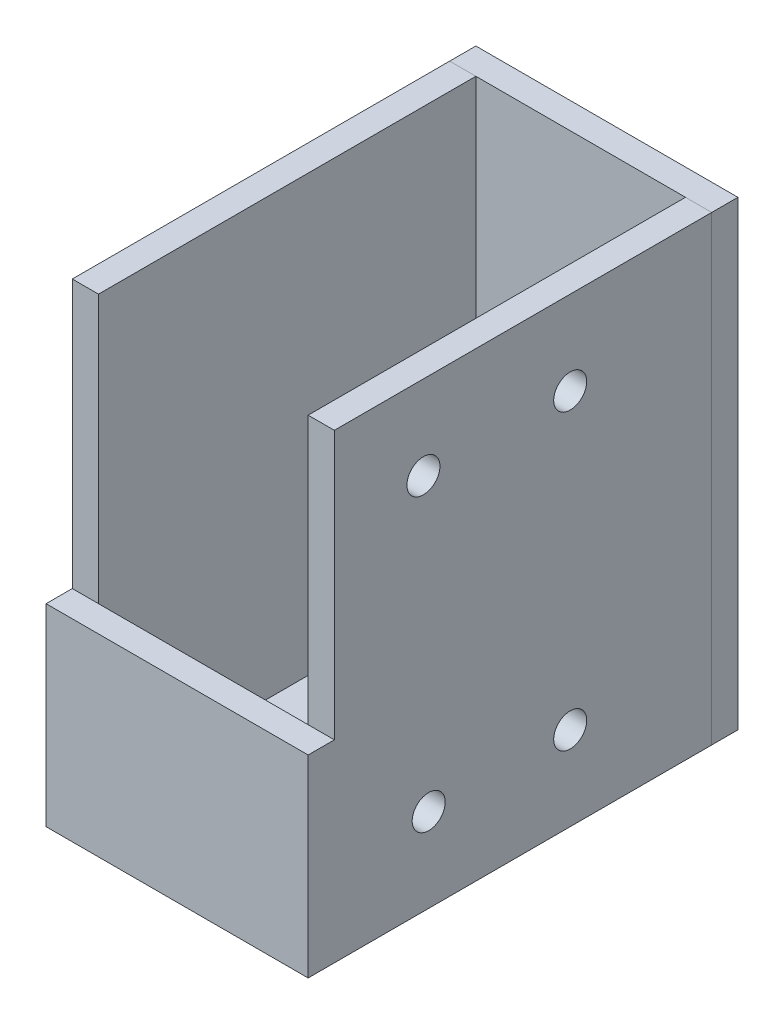
from build123d import *

# Parameters (mm, degrees)
BOSS_EXTRUDE1_DEPTH = 45.72
SKETCH2_W           = 31.75
SKETCH2_H           = 55.88
BOSS_EXTRUDE2_DEPTH = 3.175
SKETCH3_W           = 31.75
SKETCH3_H           = 55.88
SKETCH3_R           = 3.712440594
BOSS_EXTRUDE3_DEPTH = 3.175
SKETCH4_R           = 2
CUT_EXTRUDE1_DEPTH  = 3.175
SKETCH5_W           = 31.75
SKETCH5_H           = 32.479121714
CUT_EXTRUDE2_DEPTH  = 3.175


with BuildPart() as part:
    # Sketch1 → Boss-Extrude1 (new body)
    with BuildSketch(Plane.XY):
        Polygon((0, 0), (0, 55.88), (3.175, 55.88), (3.175, 3.175), (28.575, 3.175), (28.575, 55.88), (31.75, 55.88), (31.75, 0), align=None)
    extrude(amount=BOSS_EXTRUDE1_DEPTH)

    # Sketch3 → Boss-Extrude3 (add)
    with BuildSketch(Plane.XY.offset(45.72)):
        with Locations((15.875, 27.94)):
            Rectangle(SKETCH3_W, SKETCH3_H)
        with Locations((15.875, 40.426288934)):
            Circle(SKETCH3_R, mode=Mode.SUBTRACT)
    extrude(amount=BOSS_EXTRUDE3_DEPTH)

    # Sketch4 → Cut-Extrude1 (cut)
    with BuildSketch(Plane(origin=(31.75, 0, 0), x_dir=(0, 0, -1), z_dir=(1, 0, 0))):
        with Locations((-17.145, 45.72)):
            Circle(SKETCH4_R)
        with Locations((-34.29, 10.16)):
            Circle(SKETCH4_R)
        with Locations((-17.145, 10.16)):
            Circle(SKETCH4_R)
        with Locations((-34.925, 45.72)):
            Circle(SKETCH4_R)
    extrude(amount=-CUT_EXTRUDE1_DEPTH, mode=Mode.SUBTRACT)

    # Sketch5 → Cut-Extrude2 (cut)
    with BuildSketch(Plane.XY.offset(48.895)):
        with Locations((15.875, 39.640439143)):
            Rectangle(SKETCH5_W, SKETCH5_H)
    extrude(amount=-CUT_EXTRUDE2_DEPTH, mode=Mode.SUBTRACT)


with BuildPart() as body_2:
    # Sketch2 → Boss-Extrude2 (new body)
    with BuildSketch(Plane(origin=(0, 0, 0), x_dir=(-1, 0, 0), z_dir=(0, 0, -1))):
        with Locations((-15.875, 27.94)):
            Rectangle(SKETCH2_W, SKETCH2_H)
    extrude(amount=BOSS_EXTRUDE2_DEPTH)


solid = Compound([part.part, body_2.part])
